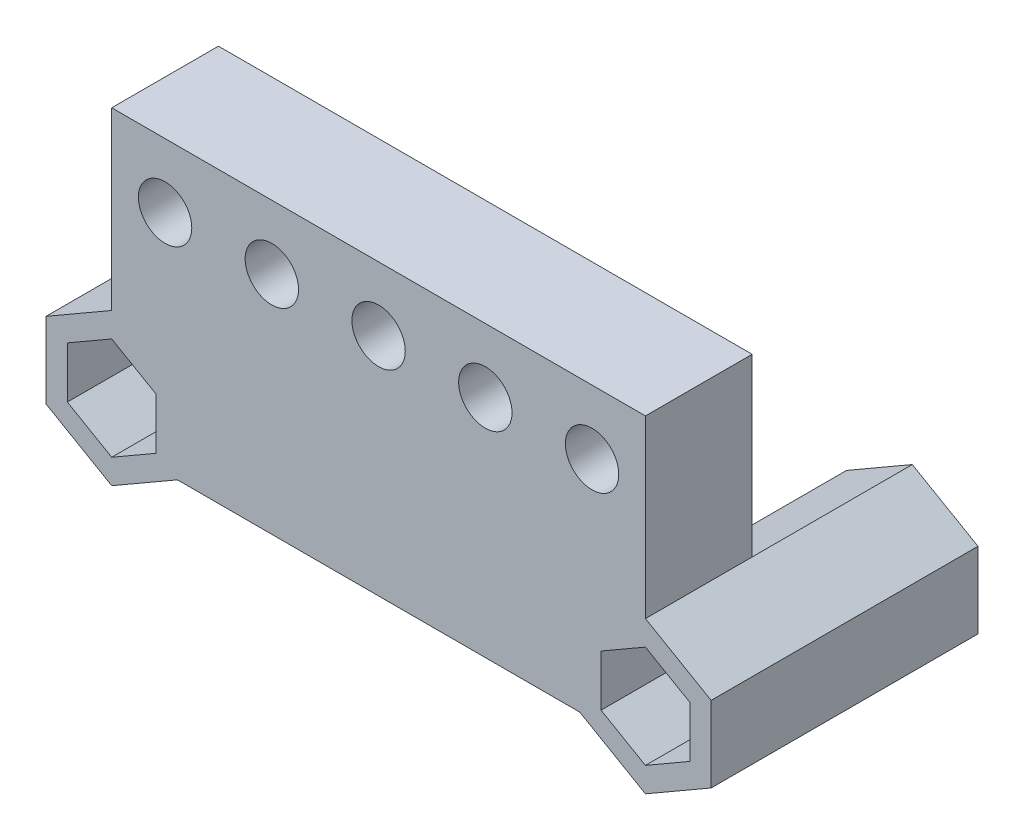
from build123d import *

# Parameters (mm, degrees)
BOSS_EXTRUDE1_DEPTH   = 25
BOSS_EXTRUDE1_2_DEPTH = 25
BOSS_EXTRUDE2_REACH   = 58.352
SKETCH2_W             = 10
SKETCH2_H             = 7.109401076
BOSS_EXTRUDE3_DEPTH   = 10
SKETCH4_R             = 2.5
CUT_EXTRUDE1_DEPTH    = 66.828745993


with BuildPart() as part:
    # Sketch1 → Boss-Extrude1 (new body)
    with BuildSketch(Plane.XY):
        Polygon((-6.156921938, -3.554700538), (0, -7.109401077), (6.156921938, -3.554700538), (6.156921938, 3.554700538), (0, 7.109401077), (-6.156921938, 3.554700538), align=None)
        Polygon((-4.156921938, 2.4), (-4.156921938, -2.4), (0, -4.8), (4.156921938, -2.4), (4.156921938, 2.4), (0, 4.8), align=None, mode=Mode.SUBTRACT)
    extrude(amount=BOSS_EXTRUDE1_DEPTH)


with BuildPart() as body_2:
    # Sketch1 → Boss-Extrude1 2 (new body)
    with BuildSketch(Plane.XY):
        Polygon((43.843078062, -3.554700538), (50, -7.109401077), (56.156921938, -3.554700538), (56.156921938, 3.554700538), (50, 7.109401077), (43.843078062, 3.554700538), align=None)
        Polygon((45.843078062, -2.4), (50, -4.8), (54.156921938, -2.4), (54.156921938, 2.4), (50, 4.8), (45.843078062, 2.4), align=None, mode=Mode.SUBTRACT)
    extrude(amount=BOSS_EXTRUDE1_2_DEPTH)

    # Boss-Extrude2: up to this face of the body (flat: up to its plane)
    boss_extrude2_end = Plane(body_2.part.faces().sort_by_distance((43.843078062, 0, 12.5))[0])
    # Sketch2 → Boss-Extrude2 (add, up to the picked face)
    with BuildSketch(Plane(origin=(6.156921938, 0, 0), x_dir=(0, 0, -1), z_dir=(1, 0, 0)), mode=Mode.PRIVATE) as boss_extrude2_sk1:
        with Locations((-20, 0)):
            Rectangle(SKETCH2_W, SKETCH2_H)
    boss_extrude2_tool1 = split(extrude(boss_extrude2_sk1.sketch, amount=BOSS_EXTRUDE2_REACH, mode=Mode.PRIVATE), bisect_by=boss_extrude2_end, keep=Keep.BOTH, mode=Mode.PRIVATE)

    add(part.part)  # Boss-Extrude2 merges part
    add(boss_extrude2_tool1.solids().sort_by(Axis((6.156922, 0, 20), (1, 0, 0)))[0])

    # Sketch3 → Boss-Extrude3 (add)
    with BuildSketch(Plane.XY.offset(25)):
        Polygon((50, 7.109401077), (50, 23.554700538), (0, 23.554700538), (0, 7.109401077), (6.156921938, 3.554700538), (43.843078062, 3.554700538), align=None)
    extrude(amount=-BOSS_EXTRUDE3_DEPTH)

    # Sketch4 → Cut-Extrude1 (cut, through all)
    with BuildSketch(Plane.XY.offset(25)):
        with Locations((25, 17.554700538)):
            Circle(SKETCH4_R)
        with Locations((35, 17.554700538)):
            Circle(SKETCH4_R)
        with Locations((45, 17.554700538)):
            Circle(SKETCH4_R)
        with Locations((15, 17.554700538)):
            Circle(SKETCH4_R)
        with Locations((5, 17.554700538)):
            Circle(SKETCH4_R)
    extrude(amount=-CUT_EXTRUDE1_DEPTH, mode=Mode.SUBTRACT)


solid = body_2.part
